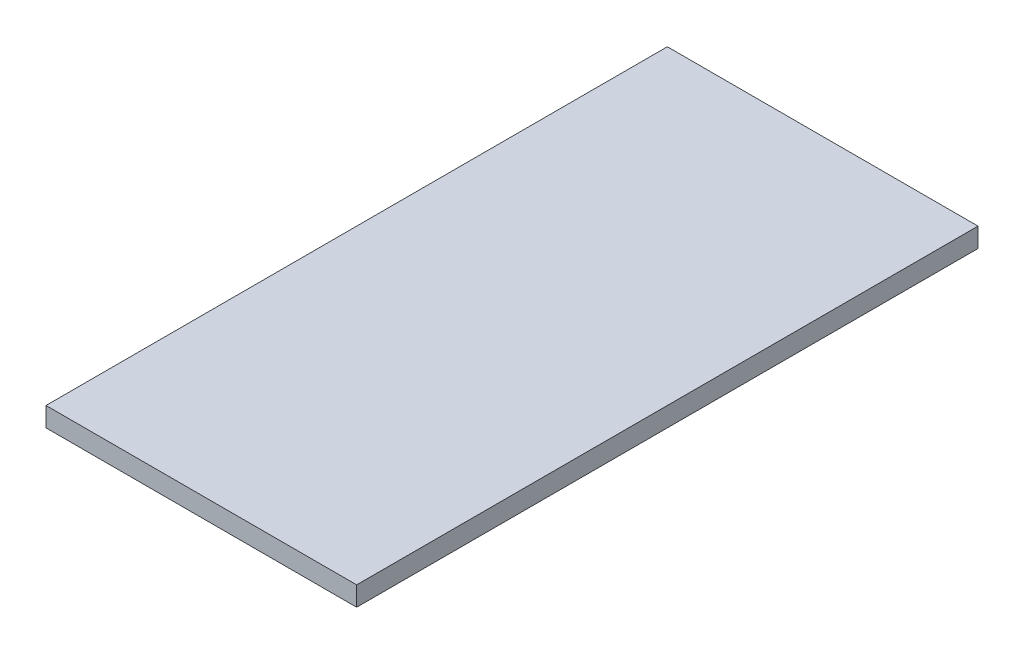
from build123d import *

# Parameters (mm, degrees)
SKETCH1_W           = 203.2
SKETCH1_H           = 406.4
BOSS_EXTRUDE1_DEPTH = 12.7


with BuildPart() as part:
    # Sketch1 → Boss-Extrude1 (new body)
    with BuildSketch(Plane(origin=(0, 0, 0), x_dir=(1, 0, 0), z_dir=(0, 1, 0))):
        with Locations((101.6, 203.2)):
            Rectangle(SKETCH1_W, SKETCH1_H)
    extrude(amount=BOSS_EXTRUDE1_DEPTH)


solid = part.part
